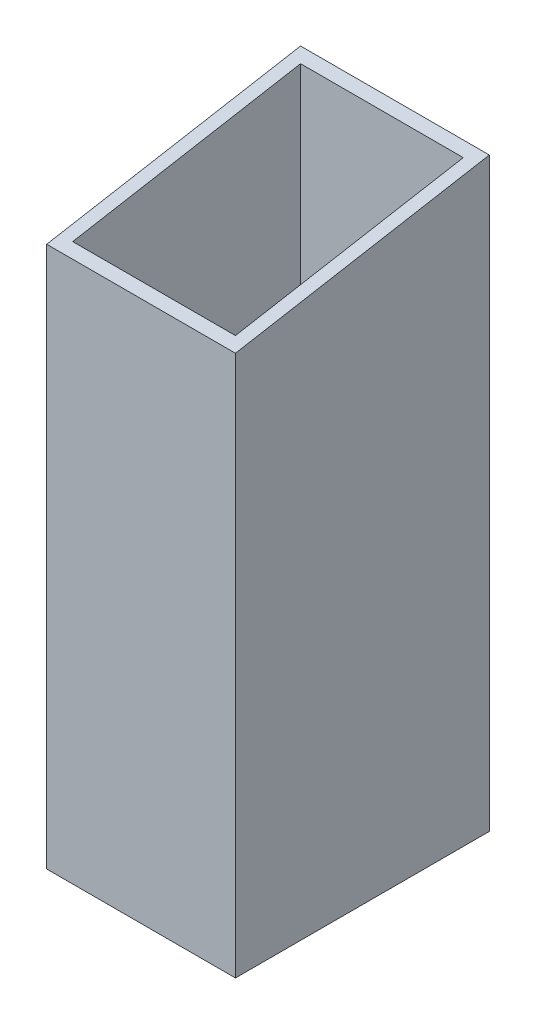
from build123d import *

# Parameters (mm, degrees)
SKETCH1_W               = 29
SKETCH1_H               = 39
BOSS_EXTRUDE1_DEPTH     = 90
SHELL1_T                = -2
CUT_EXTRUDE1_DEPTH      = 103.28391858
CUT_EXTRUDE1_DEPTH_BACK = 103.28391858


with BuildPart() as part:
    # Sketch1 → Boss-Extrude1 (new body)
    with BuildSketch(Plane(origin=(0, 0, 0), x_dir=(1, 0, 0), z_dir=(0, 1, 0))):
        with Locations((14.5, 19.5)):
            Rectangle(SKETCH1_W, SKETCH1_H)
    extrude(amount=BOSS_EXTRUDE1_DEPTH)

    # Shell1
    shell1_openings = [part.faces().sort_by_distance(p)[0] for p in [
        (14.5, 90, -19.5),
    ]]
    offset(amount=SHELL1_T, openings=shell1_openings, kind=Kind.INTERSECTION)

    # Sketch3 → Cut-Extrude1 (cut, two sides: drawn at the far end of the back side and taken through both)
    with BuildSketch(Plane.ZY.offset(-CUT_EXTRUDE1_DEPTH_BACK)):
        Polygon((-242.041155587, 125.801633924), (-39, 90), (0, 83.123247752), (203.041155587, 47.321613828), (274.644423436, 453.403925002), (-170.437887739, 531.883945099), align=None)
    extrude(amount=CUT_EXTRUDE1_DEPTH + CUT_EXTRUDE1_DEPTH_BACK, mode=Mode.SUBTRACT)


solid = part.part
